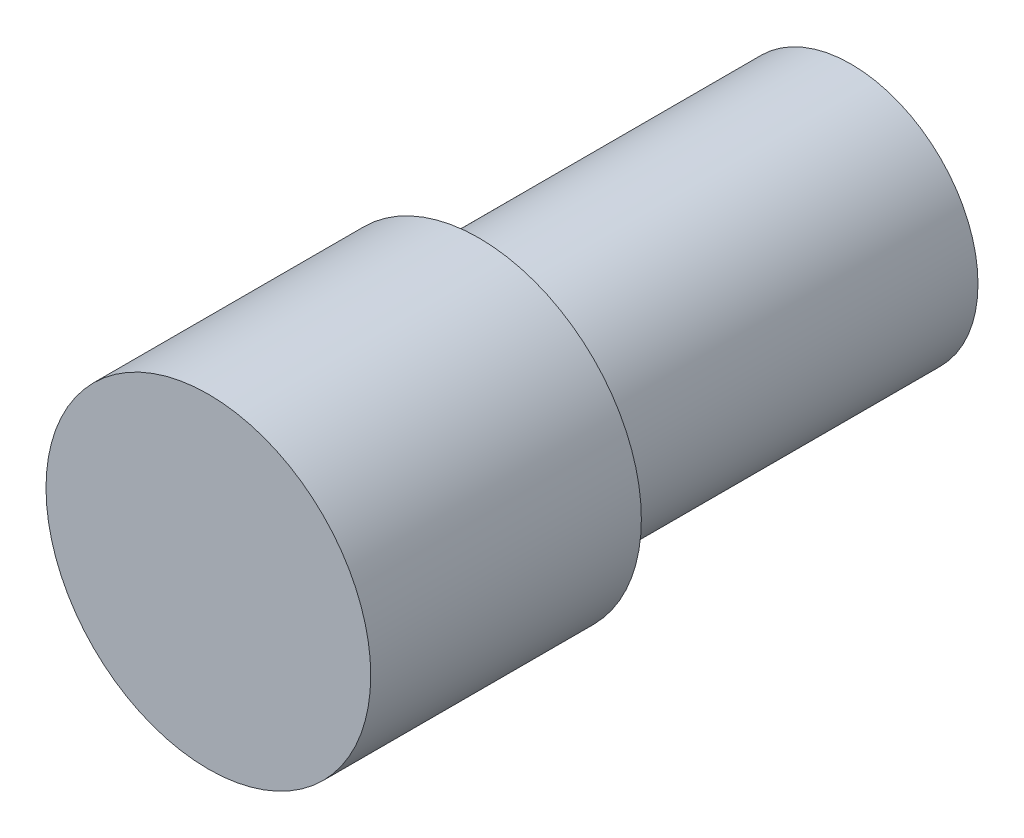
from build123d import *

# Parameters (mm, degrees)
SKETCH1_R           = 6
BOSS_EXTRUDE1_DEPTH = 10
SKETCH3_R           = 4.69
BOSS_EXTRUDE2_DEPTH = 13.75
SKETCH4_R           = 1.15
CUT_EXTRUDE1_DEPTH  = 13.75


with BuildPart() as part:
    # Sketch1 → Boss-Extrude1 (new body)
    with BuildSketch(Plane.XY):
        Circle(SKETCH1_R)
    extrude(amount=BOSS_EXTRUDE1_DEPTH)

    # Sketch3 → Boss-Extrude2 (add)
    with BuildSketch(Plane(origin=(0, 0, 0), x_dir=(-1, 0, 0), z_dir=(0, 0, -1))):
        with Locations(Location((0, 0, 0), (0, 0, 180))):
            Circle(SKETCH3_R)
    extrude(amount=BOSS_EXTRUDE2_DEPTH)

    # Sketch4 → Cut-Extrude1 (cut)
    with BuildSketch(Plane(origin=(0, 0, -13.75), x_dir=(-1, 0, 0), z_dir=(0, 0, -1))):
        Circle(SKETCH4_R)
    extrude(amount=-CUT_EXTRUDE1_DEPTH, mode=Mode.SUBTRACT)


solid = part.part
